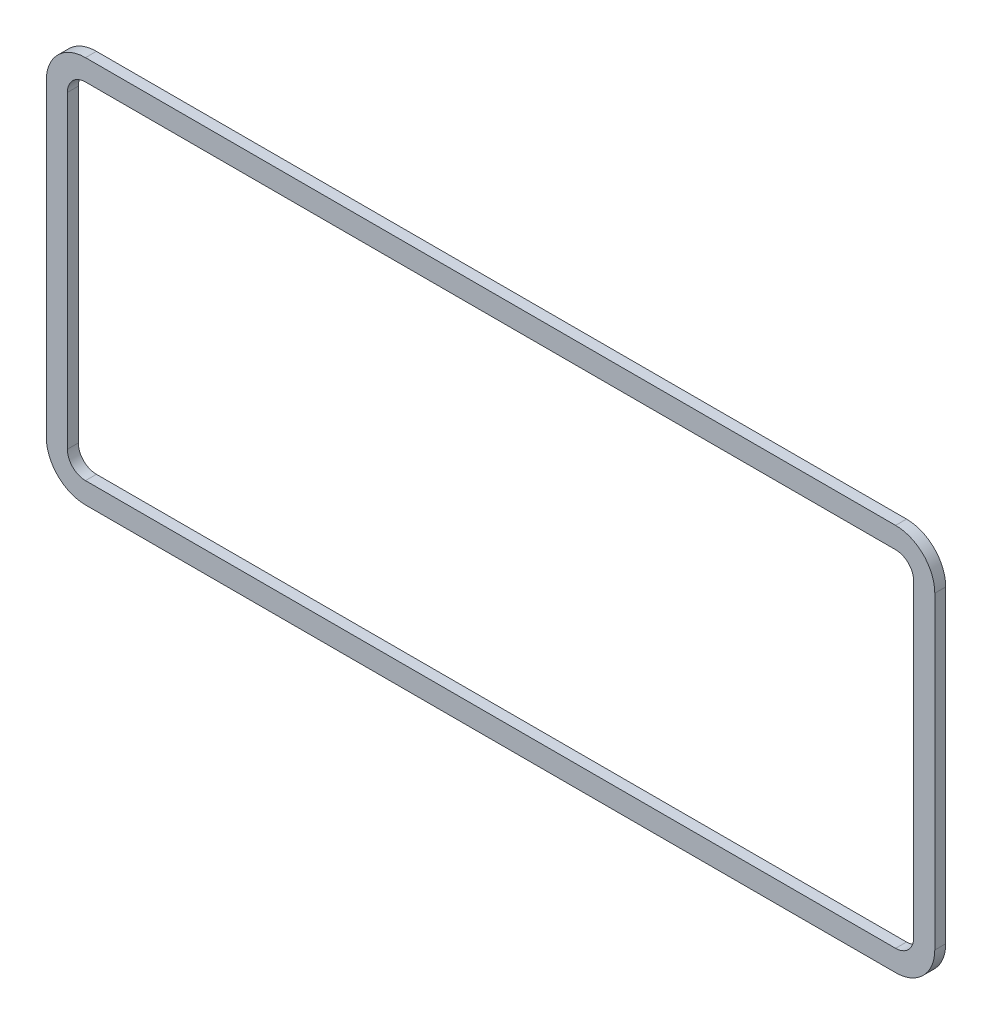
from build123d import *

# Parameters (mm, degrees)
BOSS_EXTRUDE1_DEPTH = 1.9939


with BuildPart() as part:
    # Sketch1 → Boss-Extrude1 (new body)
    with BuildSketch(Plane.XY):
        with BuildLine():
            Line((-73.914, -35.3441), (73.914, -35.3441))
            ThreePointArc((73.914, -35.3441), (78.969884196, -33.249884196), (81.0641, -28.194))
            Line((81.0641, -28.194), (81.0641, 28.194))
            ThreePointArc((81.0641, 28.194), (78.969884196, 33.249884196), (73.914, 35.3441))
            Line((73.914, 35.3441), (-73.914, 35.3441))
            ThreePointArc((-73.914, 35.3441), (-78.969884196, 33.249884196), (-81.0641, 28.194))
            Line((-81.0641, 28.194), (-81.0641, -28.194))
            ThreePointArc((-81.0641, -28.194), (-78.969884196, -33.249884196), (-73.914, -35.3441))
        make_face()
        with BuildLine():
            Line((-73.914, -31.496), (73.914, -31.496))
            ThreePointArc((73.914, -31.496), (76.248866591, -30.528866591), (77.216, -28.194))
            Line((77.216, -28.194), (77.216, 28.194))
            ThreePointArc((77.216, 28.194), (76.248866591, 30.528866591), (73.914, 31.496))
            Line((73.914, 31.496), (-73.914, 31.496))
            ThreePointArc((-73.914, 31.496), (-76.248866591, 30.528866591), (-77.216, 28.194))
            Line((-77.216, 28.194), (-77.216, -28.194))
            ThreePointArc((-77.216, -28.194), (-76.248866591, -30.528866591), (-73.914, -31.496))
        make_face(mode=Mode.SUBTRACT)
    extrude(amount=BOSS_EXTRUDE1_DEPTH)


solid = part.part
